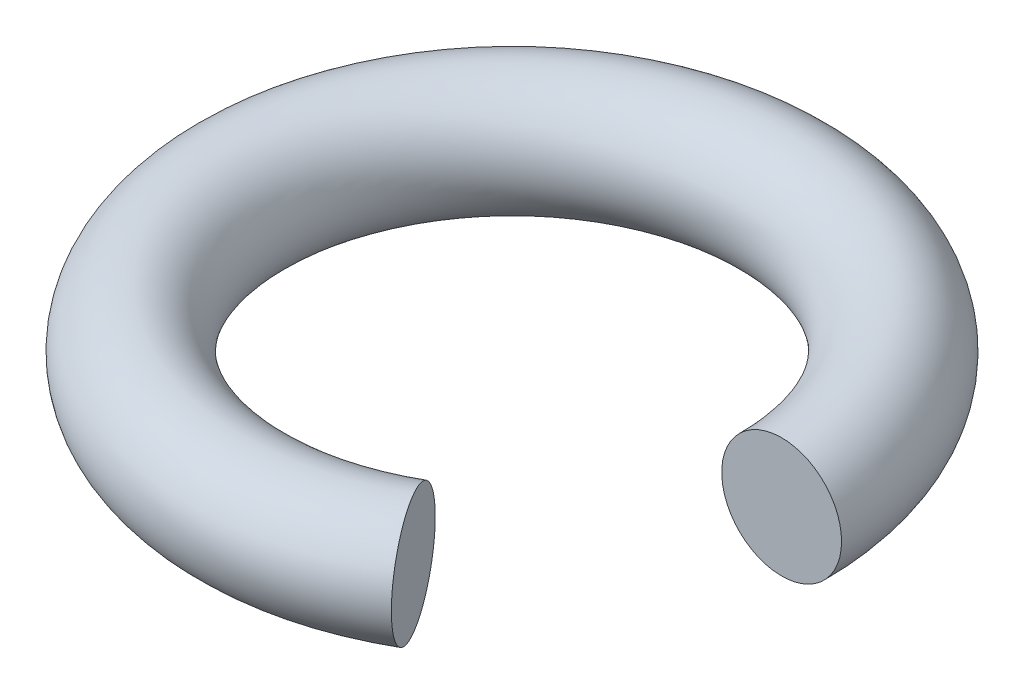
from build123d import *

# Parameters (mm, degrees)
RECONSTRUCTED_NOMINAL_AXIAL_PROFILE_R = 0.6
NATIVE_REVOLVED_GEOMETRY_ANGLE        = 300


with BuildPart() as part:
    # Reconstructed nominal axial profile → Native revolved geometry (revolve)
    with BuildSketch(Plane.XY):
        with Locations((2.7, 0)):
            Circle(RECONSTRUCTED_NOMINAL_AXIAL_PROFILE_R)
    revolve(axis=Axis((0, -500, 0), (0, 1, 0)), revolution_arc=NATIVE_REVOLVED_GEOMETRY_ANGLE)


solid = part.part
